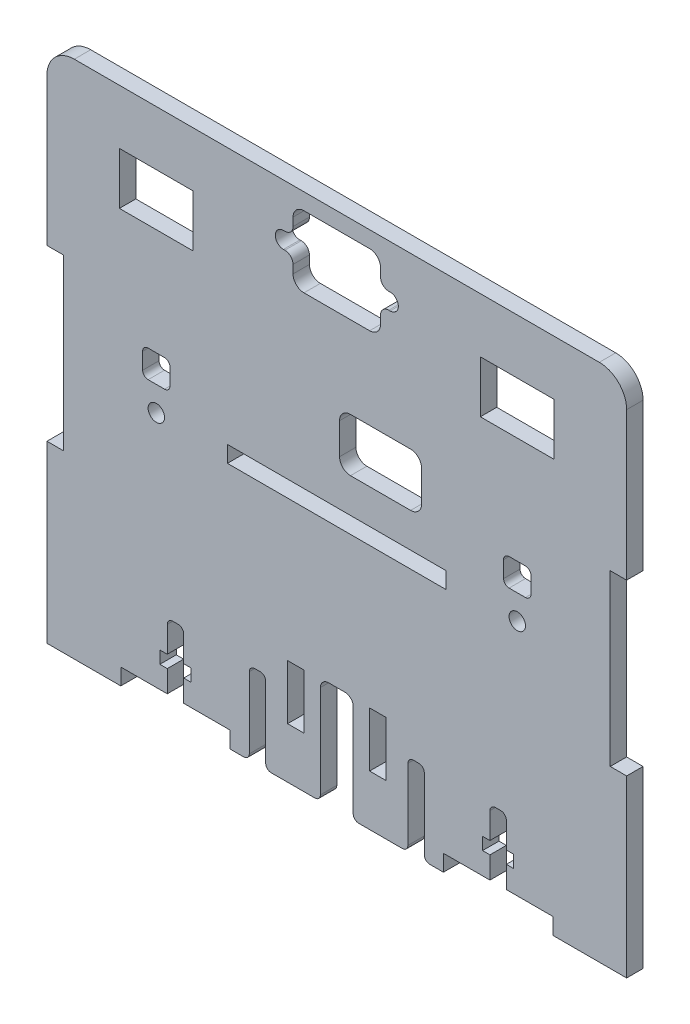
from build123d import *

# Parameters (mm, degrees)
ESBO_O1_W                = 100
ESBO_O1_H                = 95
RESSALTO_EXTRUS_O1_DEPTH = 1.5
ESBO_O3_W                = 3
ESBO_O3_H                = 32
RESSALTO_EXTRUS_O2_DEPTH = 3
ESBO_O2_R                = 1.5
ESBO_O2_W                = 40
ESBO_O2_H                = 3
CORTE_EXTRUS_O1_DEPTH    = 72.233770081
CUT_EXTRUDE3_DEPTH       = 72.233770081
CUT_EXTRUDE3_DEPTH_BACK  = 72.233770081
CUT_EXTRUDE5_DEPTH       = 72.186375101
CUT_EXTRUDE5_DEPTH_BACK  = 72.186375101
CUT_EXTRUDE6_DEPTH       = 72.186375101
CUT_EXTRUDE6_DEPTH_BACK  = 72.186375101
SKETCH7_W                = 13.5
SKETCH7_H                = 9.5
CUT_EXTRUDE7_DEPTH       = 72.186375101
CUT_EXTRUDE7_DEPTH_BACK  = 72.186375101
SKETCH8_W                = 3
SKETCH8_H                = 10
CUT_EXTRUDE8_DEPTH       = 72.186375101
CUT_EXTRUDE8_DEPTH_BACK  = 72.186375101
CUT_EXTRUDE10_DEPTH      = 72.186375101
CUT_EXTRUDE10_DEPTH_BACK = 72.186375101
CUT_EXTRUDE11_DEPTH      = 72.186375101
CUT_EXTRUDE11_DEPTH_BACK = 72.186375101
FILLET1_R                = 1
FILLET2_R                = 5


with BuildPart() as part:
    # Esboço1 → Ressalto-extrusão1 (new, symmetric)
    with BuildSketch(Plane.XY):
        Rectangle(ESBO_O1_W, ESBO_O1_H)
    extrude(amount=RESSALTO_EXTRUS_O1_DEPTH, both=True)

    # Esboço3 → Ressalto-extrusão2 (add, through all)
    with BuildSketch(Plane.XY.offset(1.5)):
        with Locations((-51.5, 31.5)):
            Rectangle(ESBO_O3_W, ESBO_O3_H)
        with Locations((-51.5, -31.5)):
            Rectangle(ESBO_O3_W, ESBO_O3_H)
        with Locations((51.5, -31.5)):
            Rectangle(ESBO_O3_W, ESBO_O3_H)
        with Locations((51.5, 31.5)):
            Rectangle(ESBO_O3_W, ESBO_O3_H)
    extrude(amount=-RESSALTO_EXTRUS_O2_DEPTH)

    # Esboço2 → Corte-extrusão1 (cut, through all)
    with BuildSketch(Plane.XY.offset(1.5)):
        with Locations((-33, -1)):
            Circle(ESBO_O2_R)
        with Locations(Location((33, -1, 0), (0, 0, 180))):
            Circle(ESBO_O2_R)
        with Locations((0, -1)):
            Rectangle(ESBO_O2_W, ESBO_O2_H)
    extrude(amount=-CORTE_EXTRUS_O1_DEPTH, mode=Mode.SUBTRACT)

    # Sketch4 → Cut-Extrude3 (cut, two sides: drawn at the far end of the back side and taken through both)
    with BuildSketch(Plane.XY.offset(1.5).offset(-CUT_EXTRUDE3_DEPTH_BACK)):
        with BuildLine():
            Line((-34.5, 8.5), (-31.5, 8.5))
            ThreePointArc((-31.5, 8.5), (-30.792893219, 8.207106781), (-30.5, 7.5))
            Line((-30.5, 7.5), (-30.5, 4.5))
            ThreePointArc((-30.5, 4.5), (-30.792893219, 3.792893219), (-31.5, 3.5))
            Line((-31.5, 3.5), (-34.5, 3.5))
            ThreePointArc((-34.5, 3.5), (-35.207106781, 3.792893219), (-35.5, 4.5))
            Line((-35.5, 4.5), (-35.5, 7.5))
            ThreePointArc((-35.5, 7.5), (-35.207106781, 8.207106781), (-34.5, 8.5))
        make_face()
        with BuildLine():
            Line((30.5, 7.5), (30.5, 4.5))
            ThreePointArc((30.5, 4.5), (30.792893219, 3.792893219), (31.5, 3.5))
            Line((31.5, 3.5), (34.5, 3.5))
            ThreePointArc((34.5, 3.5), (35.207106781, 3.792893219), (35.5, 4.5))
            Line((35.5, 4.5), (35.5, 7.5))
            ThreePointArc((35.5, 7.5), (35.207106781, 8.207106781), (34.5, 8.5))
            Line((34.5, 8.5), (31.5, 8.5))
            ThreePointArc((31.5, 8.5), (30.792893219, 8.207106781), (30.5, 7.5))
        make_face()
    extrude(amount=CUT_EXTRUDE3_DEPTH + CUT_EXTRUDE3_DEPTH_BACK, mode=Mode.SUBTRACT)

    # Sketch6 → Cut-Extrude5 (cut, two sides: drawn at the far end of the back side and taken through both)
    with BuildSketch(Plane.XY.offset(-CUT_EXTRUDE5_DEPTH_BACK)):
        with BuildLine():
            Line((-6, 44.5), (6, 44.5))
            ThreePointArc((6, 44.5), (7.414213562, 43.914213562), (8, 42.5))
            Line((8, 42.5), (8, 41))
            ThreePointArc((8, 41), (8.439339828, 39.939339828), (9.5, 39.5))
            Line((9.5, 39.5), (9.75, 39.5))
            ThreePointArc((9.75, 39.5), (11.25, 38), (9.75, 36.5))
            Line((9.75, 36.5), (9.5, 36.5))
            ThreePointArc((9.5, 36.5), (8.439339828, 36.060660172), (8, 35))
            Line((8, 35), (8, 33.5))
            ThreePointArc((8, 33.5), (7.414213562, 32.085786438), (6, 31.5))
            Line((6, 31.5), (-6, 31.5))
            ThreePointArc((-6, 31.5), (-7.414213562, 32.085786438), (-8, 33.5))
            Line((-8, 33.5), (-8, 35))
            ThreePointArc((-8, 35), (-8.439339828, 36.060660172), (-9.5, 36.5))
            Line((-9.5, 36.5), (-9.75, 36.5))
            ThreePointArc((-9.75, 36.5), (-11.25, 38), (-9.75, 39.5))
            Line((-9.75, 39.5), (-9.5, 39.5))
            ThreePointArc((-9.5, 39.5), (-8.439339828, 39.939339828), (-8, 41))
            Line((-8, 41), (-8, 42.5))
            ThreePointArc((-8, 42.5), (-7.414213562, 43.914213562), (-6, 44.5))
        make_face()
    extrude(amount=CUT_EXTRUDE5_DEPTH + CUT_EXTRUDE5_DEPTH_BACK, mode=Mode.SUBTRACT)

    # Sketch7 → Cut-Extrude6 (cut, two sides: drawn at the far end of the back side and taken through both)
    with BuildSketch(Plane.XY.offset(-CUT_EXTRUDE6_DEPTH_BACK)):
        with Locations((-33, 32.75)):
            Rectangle(SKETCH7_W, SKETCH7_H)
        with Locations((33, 32.75)):
            Rectangle(SKETCH7_W, SKETCH7_H)
    extrude(amount=CUT_EXTRUDE6_DEPTH + CUT_EXTRUDE6_DEPTH_BACK, mode=Mode.SUBTRACT)

    # Sketch8 → Cut-Extrude7 (cut, two sides: drawn at the far end of the back side and taken through both)
    with BuildSketch(Plane.XY.offset(-CUT_EXTRUDE7_DEPTH_BACK)):
        with Locations((-7.5, -33.23)):
            Rectangle(SKETCH8_W, SKETCH8_H)
        with Locations((7.5, -33.23)):
            Rectangle(SKETCH8_W, SKETCH8_H)
    extrude(amount=CUT_EXTRUDE7_DEPTH + CUT_EXTRUDE7_DEPTH_BACK, mode=Mode.SUBTRACT)

    # Sketch9 → Cut-Extrude8 (cut, two sides: drawn at the far end of the back side and taken through both)
    with BuildSketch(Plane.XY.offset(-CUT_EXTRUDE8_DEPTH_BACK)):
        with BuildLine():
            Line((2.5, 16.5), (13.5, 16.5))
            ThreePointArc((13.5, 16.5), (14.914213562, 15.914213562), (15.5, 14.5))
            Line((15.5, 14.5), (15.5, 8.8))
            ThreePointArc((15.5, 8.8), (14.914213562, 7.385786438), (13.5, 6.8))
            Line((13.5, 6.8), (2.5, 6.8))
            ThreePointArc((2.5, 6.8), (1.085786438, 7.385786438), (0.5, 8.8))
            Line((0.5, 8.8), (0.5, 14.5))
            ThreePointArc((0.5, 14.5), (1.085786438, 15.914213562), (2.5, 16.5))
        make_face()
    extrude(amount=CUT_EXTRUDE8_DEPTH + CUT_EXTRUDE8_DEPTH_BACK, mode=Mode.SUBTRACT)

    # Sketch11 → Cut-Extrude10 (cut, two sides: drawn at the far end of the back side and taken through both)
    with BuildSketch(Plane.XY.offset(-CUT_EXTRUDE10_DEPTH_BACK)):
        with BuildLine():
            Line((13, -33.5), (13, -47.5))
            Line((13, -47.5), (16, -47.5))
            Line((16, -47.5), (16, -33.5))
            ThreePointArc((16, -33.5), (15.707106781, -32.792893219), (15, -32.5))
            Line((15, -32.5), (14, -32.5))
            ThreePointArc((14, -32.5), (13.292893219, -32.792893219), (13, -33.5))
        make_face()
        with BuildLine():
            Line((-1.5, -28), (1.5, -28))
            ThreePointArc((1.5, -28), (2.560660172, -28.439339828), (3, -29.5))
            Line((3, -29.5), (3, -47.5))
            Line((3, -47.5), (-3, -47.5))
            Line((-3, -47.5), (-3, -29.5))
            ThreePointArc((-3, -29.5), (-2.560660172, -28.439339828), (-1.5, -28))
        make_face()
        with BuildLine():
            Line((-15, -32.5), (-14, -32.5))
            ThreePointArc((-14, -32.5), (-13.292893219, -32.792893219), (-13, -33.5))
            Line((-13, -33.5), (-13, -47.5))
            Line((-13, -47.5), (-16, -47.5))
            Line((-16, -47.5), (-16, -33.5))
            ThreePointArc((-16, -33.5), (-15.707106781, -32.792893219), (-15, -32.5))
        make_face()
    extrude(amount=CUT_EXTRUDE10_DEPTH + CUT_EXTRUDE10_DEPTH_BACK, mode=Mode.SUBTRACT)

    # Sketch12 → Cut-Extrude11 (cut, two sides: drawn at the far end of the back side and taken through both)
    with BuildSketch(Plane.XY.offset(-CUT_EXTRUDE11_DEPTH_BACK)):
        with BuildLine():
            Line((-39.5, -47.5), (-19.5, -47.5))
            Line((-19.5, -47.5), (-19.5, -44.5))
            Line((-19.5, -44.5), (-28, -44.5))
            Line((-28, -44.5), (-28, -40.5))
            Line((-28, -40.5), (-26.65, -40.5))
            Line((-26.65, -40.5), (-26.65, -38.23))
            Line((-26.65, -38.23), (-28, -38.23))
            Line((-28, -38.23), (-28, -33.5))
            ThreePointArc((-28, -33.5), (-28.292893219, -32.792893219), (-29, -32.5))
            Line((-29, -32.5), (-30, -32.5))
            ThreePointArc((-30, -32.5), (-30.707106781, -32.792893219), (-31, -33.5))
            Line((-31, -33.5), (-31, -38.23))
            Line((-31, -38.23), (-32.35, -38.23))
            Line((-32.35, -38.23), (-32.35, -40.5))
            Line((-32.35, -40.5), (-31, -40.5))
            Line((-31, -40.5), (-31, -44.5))
            Line((-31, -44.5), (-39.5, -44.5))
            Line((-39.5, -44.5), (-39.5, -47.5))
        make_face()
        with BuildLine():
            Line((28, -38.23), (28, -33.5))
            ThreePointArc((28, -33.5), (28.292893219, -32.792893219), (29, -32.5))
            Line((29, -32.5), (30, -32.5))
            ThreePointArc((30, -32.5), (30.707106781, -32.792893219), (31, -33.5))
            Line((31, -33.5), (31, -38.23))
            Line((31, -38.23), (32.35, -38.23))
            Line((32.35, -38.23), (32.35, -40.5))
            Line((32.35, -40.5), (31, -40.5))
            Line((31, -40.5), (31, -44.5))
            Line((31, -44.5), (39.5, -44.5))
            Line((39.5, -44.5), (39.5, -47.5))
            Line((39.5, -47.5), (19.5, -47.5))
            Line((19.5, -47.5), (19.5, -44.5))
            Line((19.5, -44.5), (28, -44.5))
            Line((28, -44.5), (28, -40.5))
            Line((28, -40.5), (26.65, -40.5))
            Line((26.65, -40.5), (26.65, -38.23))
            Line((26.65, -38.23), (28, -38.23))
        make_face()
    extrude(amount=CUT_EXTRUDE11_DEPTH + CUT_EXTRUDE11_DEPTH_BACK, mode=Mode.SUBTRACT)

    # Fillet1
    fillet1_edges = [part.edges().sort_by_distance(p)[0] for p in [
        (16, -47.5, 0),
        (13, -47.5, 0),
        (-13, -47.5, 0),
        (-16, -47.5, 0),
        (3, -47.5, 0),
        (-3, -47.5, 0),
    ]]
    fillet(fillet1_edges, radius=FILLET1_R)

    # Fillet2
    fillet2_edges = [part.edges().sort_by_distance(p)[0] for p in [
        (-53, 47.5, 0),
        (53, 47.5, 0),
    ]]
    fillet(fillet2_edges, radius=FILLET2_R)


solid = part.part
